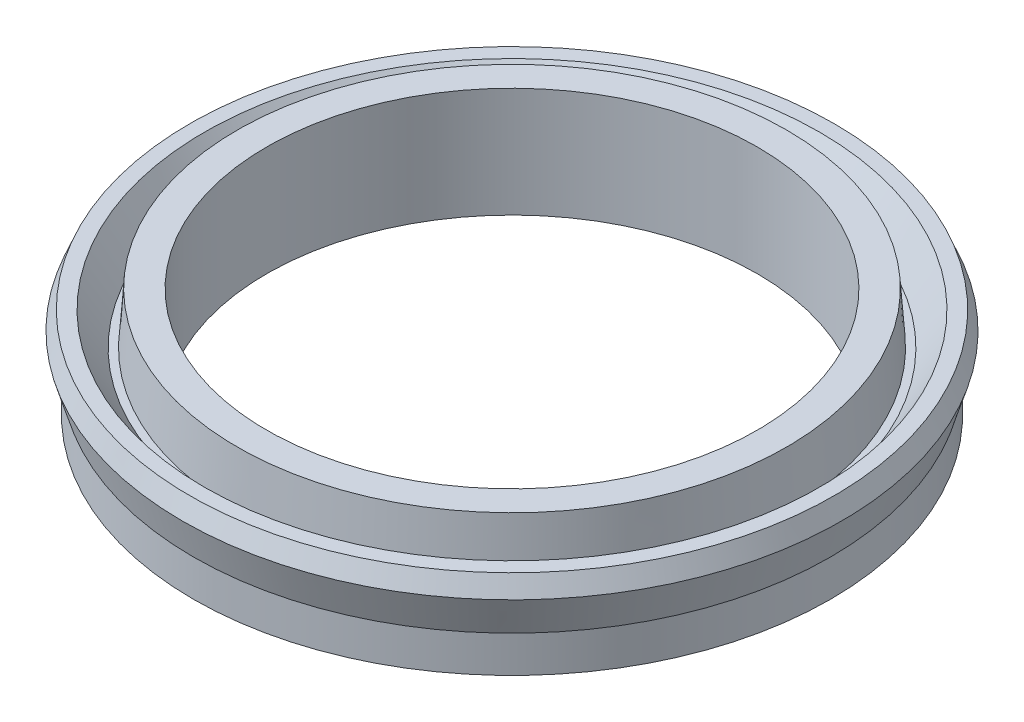
from build123d import *


with BuildPart() as part:
    # SealProfileS → SealProfile (revolve)
    with BuildSketch(Plane.XY, mode=Mode.PRIVATE) as sealprofile_sk:
        Polygon((6.7, 0), (6.7, 3), (7.5, 3), (7.6, 1.6), (7.8, 1.6), (8.4, 2.5), (8.8, 2.5), (9, 2), (8.7, 1), (8.7, 0), align=None)
    revolve(sealprofile_sk.sketch.rotate(Axis((0, 0, 0), (0, 1, 0)), 90), axis=Axis((0, 0, 0), (0, 1, 0)))


solid = part.part
